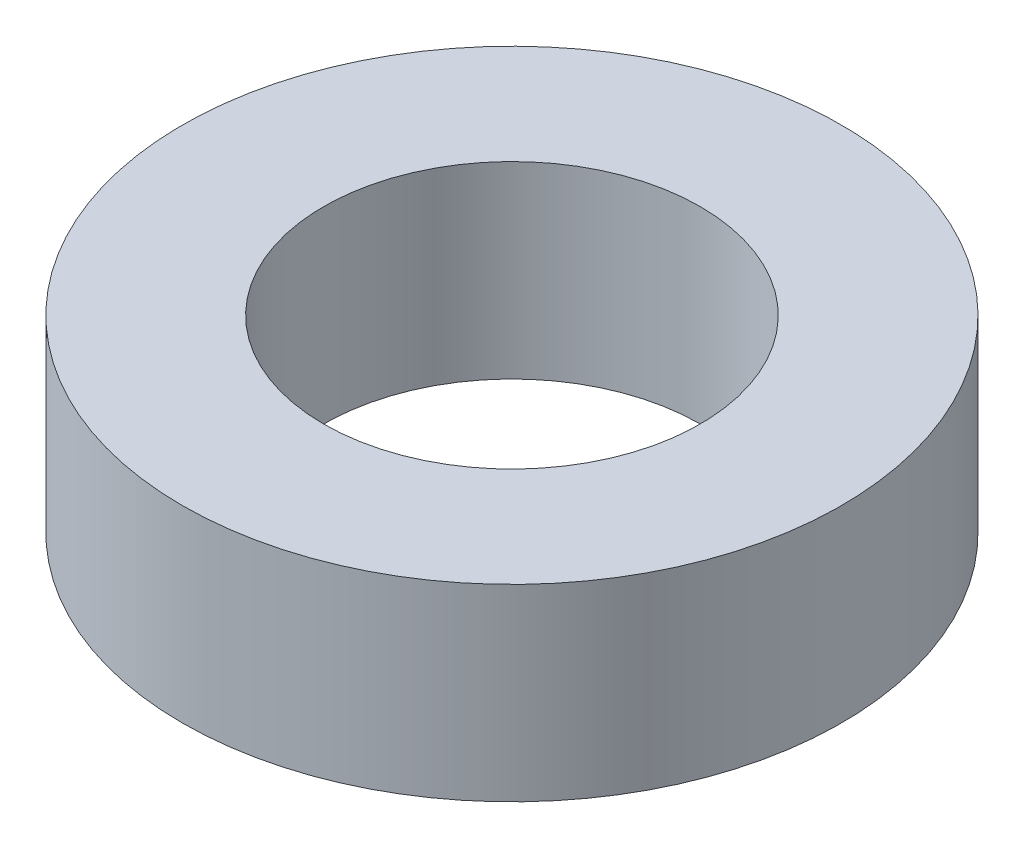
from build123d import *

# Parameters (mm, degrees)
SKETCH1_R           = 3.5
SKETCH1_R_2         = 2
BOSS_EXTRUDE1_DEPTH = 2


with BuildPart() as part:
    # Sketch1 → Boss-Extrude1 (new body)
    with BuildSketch(Plane(origin=(0, 0, 0), x_dir=(1, 0, 0), z_dir=(0, 1, 0))):
        with Locations(Location((0, 0, 0), (0, 0, 270))):
            Circle(SKETCH1_R)
        with Locations(Location((0, 0, 0), (0, 0, 270))):
            Circle(SKETCH1_R_2, mode=Mode.SUBTRACT)
    extrude(amount=BOSS_EXTRUDE1_DEPTH)


solid = part.part
